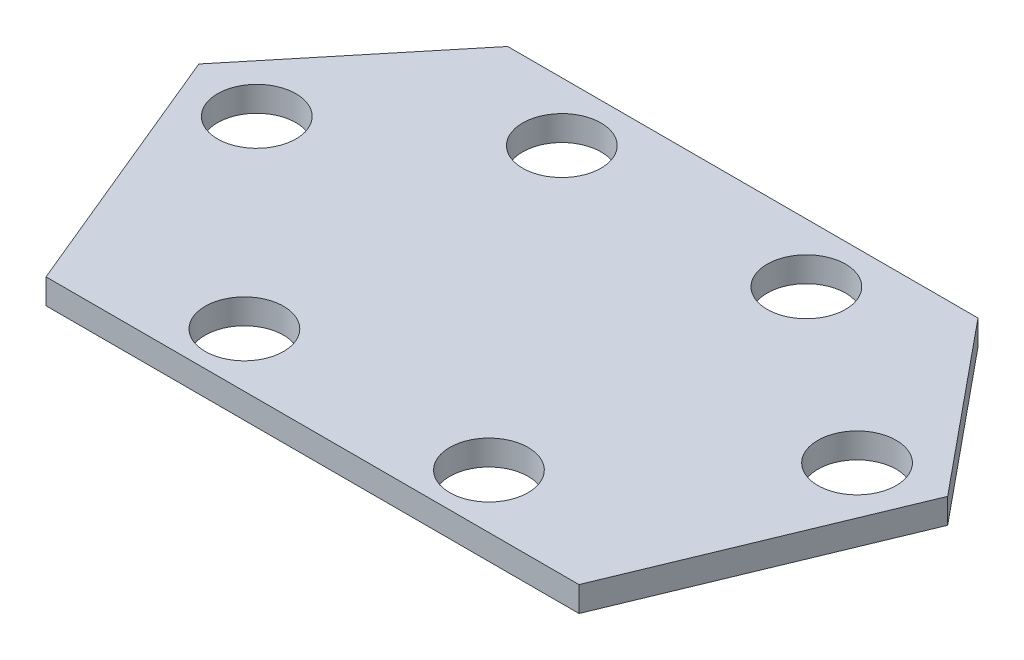
from build123d import *

# Parameters (mm, degrees)
SKETCH_1_R      = 12.5
EXTRUDE_1_DEPTH = 4


with BuildPart() as part:
    # 草图1 → 凸台-拉伸1 (new, symmetric)
    with BuildSketch(Plane(origin=(0, 0, 0), x_dir=(1, 0, 0), z_dir=(0, 1, 0))):
        Polygon((-75, 99.709683748), (75, 99.709683748), (119.42074844, 45.609802898), (85, -37.547951261), (-85, -37.547951261), (-119.42074844, 45.609802898), align=None)
        with Locations(Location((-95.730005712, 40.398538957, 0), (0, 0, 270))):
            Circle(SKETCH_1_R, mode=Mode.SUBTRACT)
        with Locations(Location((-39, 80.971951072, 0), (0, 0, 270))):
            Circle(SKETCH_1_R, mode=Mode.SUBTRACT)
        with Locations(Location((-39, -20.275462647, 0), (0, 0, 270))):
            Circle(SKETCH_1_R, mode=Mode.SUBTRACT)
        with Locations(Location((39, -20.275462647, 0), (0, 0, 90))):
            Circle(SKETCH_1_R, mode=Mode.SUBTRACT)
        with Locations(Location((39, 80.971951072, 0), (0, 0, 90))):
            Circle(SKETCH_1_R, mode=Mode.SUBTRACT)
        with Locations(Location((95.730005712, 40.398538957, 0), (0, 0, 90))):
            Circle(SKETCH_1_R, mode=Mode.SUBTRACT)
    extrude(amount=EXTRUDE_1_DEPTH, both=True)


solid = part.part
